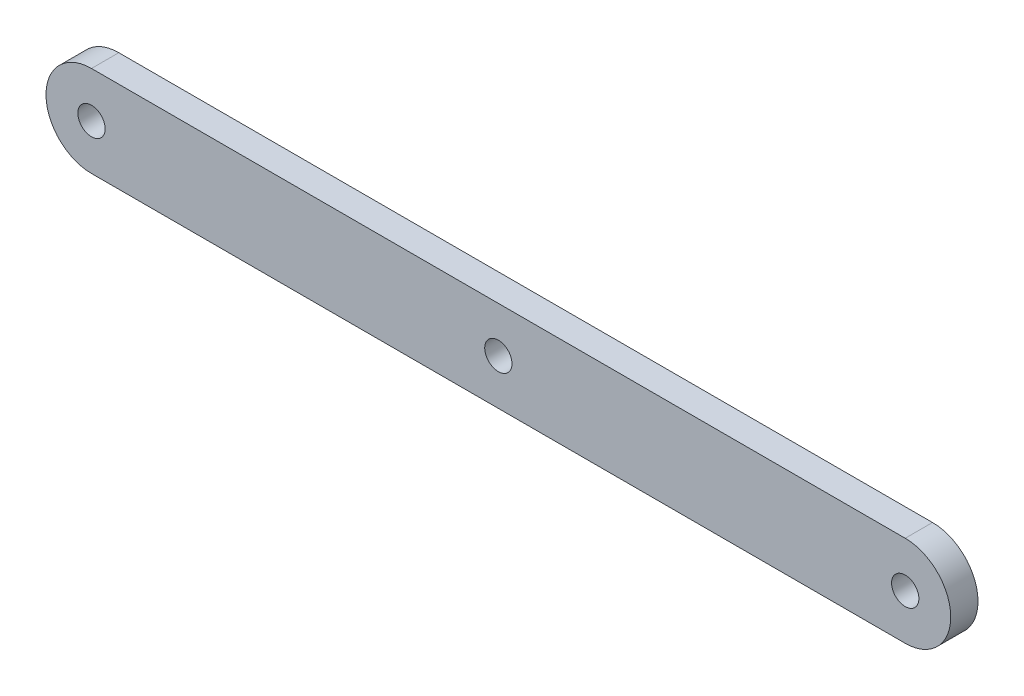
from build123d import *

# Parameters (mm, degrees)
SKETCH_1_R      = 0.75
EXTRUDE_1_DEPTH = 0.75


with BuildPart() as part:
    # 草圖1 → 填料-伸長1 (new, symmetric)
    with BuildSketch(Plane.XY):
        with BuildLine():
            Line((-22.36, 2.5), (22.36, 2.5))
            ThreePointArc((22.36, 2.5), (24.86, 0), (22.36, -2.5))
            Line((22.36, -2.5), (-22.36, -2.5))
            ThreePointArc((-22.36, -2.5), (-24.86, 0), (-22.36, 2.5))
        make_face()
        with Locations((22.36, 0)):
            Circle(SKETCH_1_R, mode=Mode.SUBTRACT)
        with Locations((-22.36, 0)):
            Circle(SKETCH_1_R, mode=Mode.SUBTRACT)
        Circle(SKETCH_1_R, mode=Mode.SUBTRACT)
    extrude(amount=EXTRUDE_1_DEPTH, both=True)


solid = part.part
